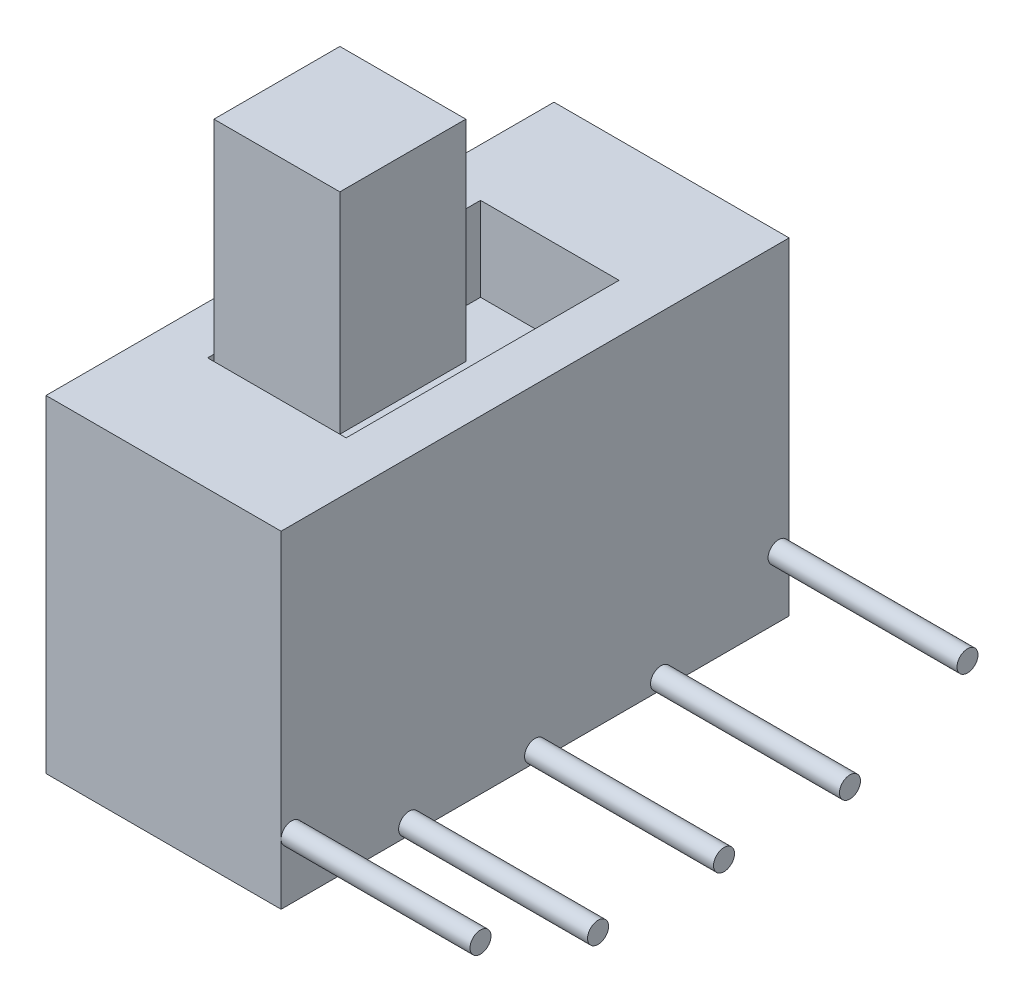
from build123d import *

# Parameters (mm, degrees)
SKETCH_1_W          = 5.6
SKETCH_1_H          = 12.1
EXTRUDE_1_DEPTH     = 7.8
SKETCH_2_W          = 3
SKETCH_2_H          = 3
EXTRUDE_2_DEPTH     = 5
SKETCH_3_R          = 0.25
EXTRUDE_3_DEPTH     = 4.5
SKETCH_5_W          = 3.3
SKETCH_5_H          = 6.5
CUT_EXTRUDE_1_DEPTH = 2


with BuildPart() as part:
    # 草图1 → 拉伸1 (new body)
    with BuildSketch(Plane(origin=(0, 0, 0), x_dir=(1, 0, 0), z_dir=(0, 1, 0))):
        Rectangle(SKETCH_1_W, SKETCH_1_H)
    extrude(amount=EXTRUDE_1_DEPTH)

    # 草图2 → 拉伸2 (add)
    with BuildSketch(Plane(origin=(0, 7.8, 0), x_dir=(-1, 0, 0), z_dir=(0, 1, 0))):
        with Locations((0, 1.85)):
            Rectangle(SKETCH_2_W, SKETCH_2_H)
    extrude(amount=EXTRUDE_2_DEPTH)

    # 草图3 → 拉伸3 (add)
    with BuildSketch(Plane(origin=(2.8, 0, 0), x_dir=(0, 0, -1), z_dir=(1, 0, 0))):
        with Locations(Location((-3, 0.25, 0), (0, 0, 270))):
            Circle(SKETCH_3_R)
        with Locations(Location((0, 0.25, 0), (0, 0, 270))):
            Circle(SKETCH_3_R)
        with Locations(Location((3, 0.25, 0), (0, 0, 180))):
            Circle(SKETCH_3_R)
        with Locations((5.8, 1.45)):
            Circle(SKETCH_3_R)
        with Locations(Location((-5.8, 1.45, 0), (0, 0, 180))):
            Circle(SKETCH_3_R)
    extrude(amount=EXTRUDE_3_DEPTH)

    # 草图5 → 切除-拉伸1 (cut)
    with BuildSketch(Plane(origin=(0, 7.8, 0), x_dir=(-1, 0, 0), z_dir=(0, 1, 0))):
        with Locations((0, 0.1)):
            Rectangle(SKETCH_5_W, SKETCH_5_H)
    extrude(amount=-CUT_EXTRUDE_1_DEPTH, mode=Mode.SUBTRACT)


with BuildPart() as cut_extrude_1_piece_1:
    # of the separate pieces the step leaves, piece 1, a body of its own (cut_extrude_1_pieces)
    add(part.part.solids().sort_by_distance((-2.8, 0, -6.05))[0])


with BuildPart() as cut_extrude_1_piece_2:
    # of the separate pieces the step leaves, piece 2, a body of its own (cut_extrude_1_pieces)
    add(part.part.solids().sort_by_distance((-1.5, 12.8, 3.35))[0])


solid = Compound([cut_extrude_1_piece_1.part, cut_extrude_1_piece_2.part])
